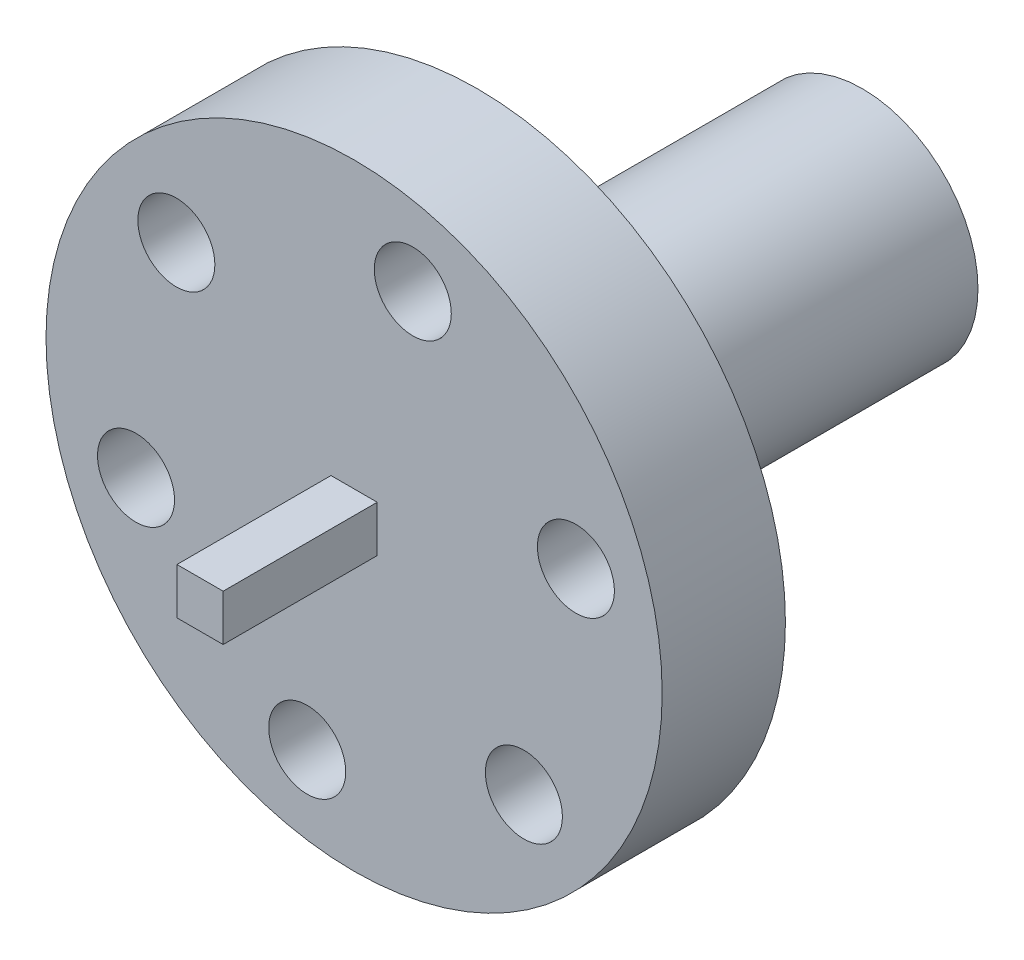
from build123d import *

# Parameters (mm, degrees)
SKETCH1_R           = 20
SKETCH1_R_2         = 2.5
BOSS_EXTRUDE1_DEPTH = 8
SKETCH2_W           = 3
SKETCH2_H           = 3
BOSS_EXTRUDE2_DEPTH = 10
SKETCH3_R           = 7.5
BOSS_EXTRUDE3_DEPTH = 25
SKETCH4_R           = 10
BOSS_EXTRUDE4_DEPTH = 5


with BuildPart() as part:
    # Sketch1 → Boss-Extrude1 (new body)
    with BuildSketch(Plane.XY):
        Circle(SKETCH1_R)
        with Locations((3.80920927, 14.508270908)):
            Circle(SKETCH1_R_2, mode=Mode.SUBTRACT)
        with Locations((14.397906738, 4.207528657)):
            Circle(SKETCH1_R_2, mode=Mode.SUBTRACT)
        with Locations((11.022029668, -10.174031029)):
            Circle(SKETCH1_R_2, mode=Mode.SUBTRACT)
        with Locations((-3.044078256, -14.687390408)):
            Circle(SKETCH1_R_2, mode=Mode.SUBTRACT)
        with Locations((-14.157363478, -4.954934573)):
            Circle(SKETCH1_R_2, mode=Mode.SUBTRACT)
        with Locations((-11.538785608, 9.58359544)):
            Circle(SKETCH1_R_2, mode=Mode.SUBTRACT)
    extrude(amount=BOSS_EXTRUDE1_DEPTH)

    # Sketch2 → Boss-Extrude2 (add)
    with BuildSketch(Plane.XY.offset(8)):
        Rectangle(SKETCH2_W, SKETCH2_H)
    extrude(amount=BOSS_EXTRUDE2_DEPTH)

    # Sketch3 → Boss-Extrude3 (add)
    with BuildSketch(Plane(origin=(0, 0, 0), x_dir=(-1, 0, 0), z_dir=(0, 0, -1))):
        with Locations(Location((0, 0, 0), (0, 0, 180))):
            Circle(SKETCH3_R)
    extrude(amount=BOSS_EXTRUDE3_DEPTH)

    # Sketch4 → Boss-Extrude4 (add)
    with BuildSketch(Plane(origin=(0, 0, 0), x_dir=(-1, 0, 0), z_dir=(0, 0, -1))):
        with Locations(Location((0, 0, 0), (0, 0, 180))):
            Circle(SKETCH4_R)
    extrude(amount=BOSS_EXTRUDE4_DEPTH)


solid = part.part
